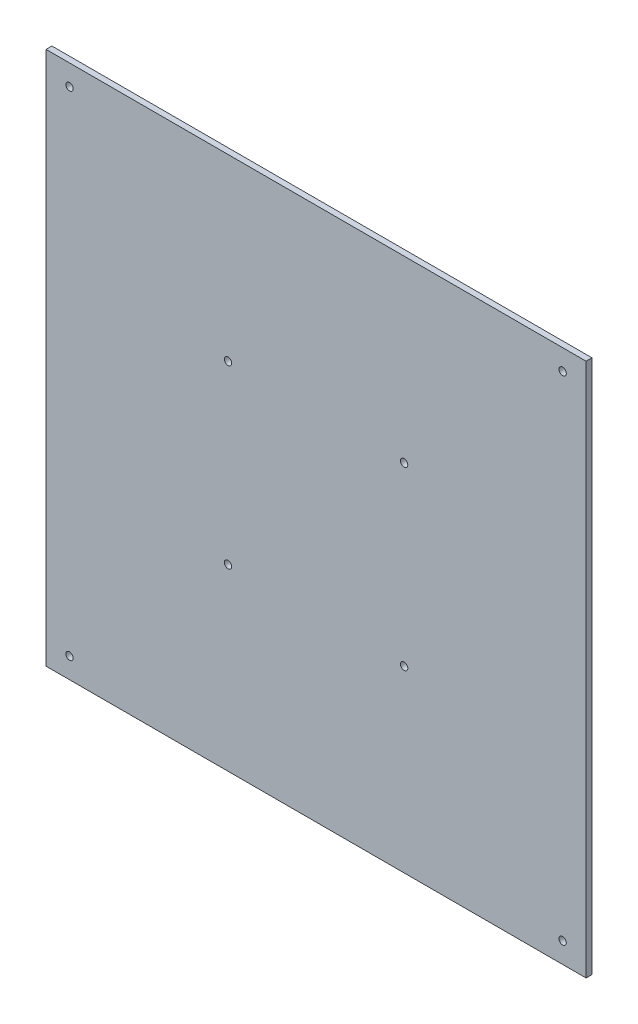
from build123d import *

# Parameters (mm, degrees)
SKETCH_1_W      = 184
SKETCH_1_H      = 182
EXTRUDE_1_DEPTH = 2
M3X0_5_1_D      = 2.5
M3X0_5_2_D      = 2.5


with BuildPart() as part:
    # ｽｹｯﾁ1 → ﾎﾞｽ - 押し出し1 (new body)
    with BuildSketch(Plane.XY):
        with Locations((92, 91)):
            Rectangle(SKETCH_1_W, SKETCH_1_H)
    extrude(amount=EXTRUDE_1_DEPTH)

    # M3x0.5 ねじ穴1 (through all)
    with Locations(Plane.XY.offset(2)):
        with Locations((8, 175), (8, 7), (176, 7), (176, 175)):
            Hole(M3X0_5_1_D / 2)

    # M3x0.5 ねじ穴2 (through all)
    with Locations(Plane.XY.offset(2)):
        with Locations((62, 61), (62, 121)):
            m3x0_5_2 = Hole(M3X0_5_2_D / 2)

    # ﾐﾗｰ1: M3x0.5 ねじ穴2 across plane
    add(m3x0_5_2.mirror(Plane(origin=(92, 0, 0), x_dir=(0, 0, 1), z_dir=(1, 0, 0))), mode=Mode.SUBTRACT)


solid = part.part
